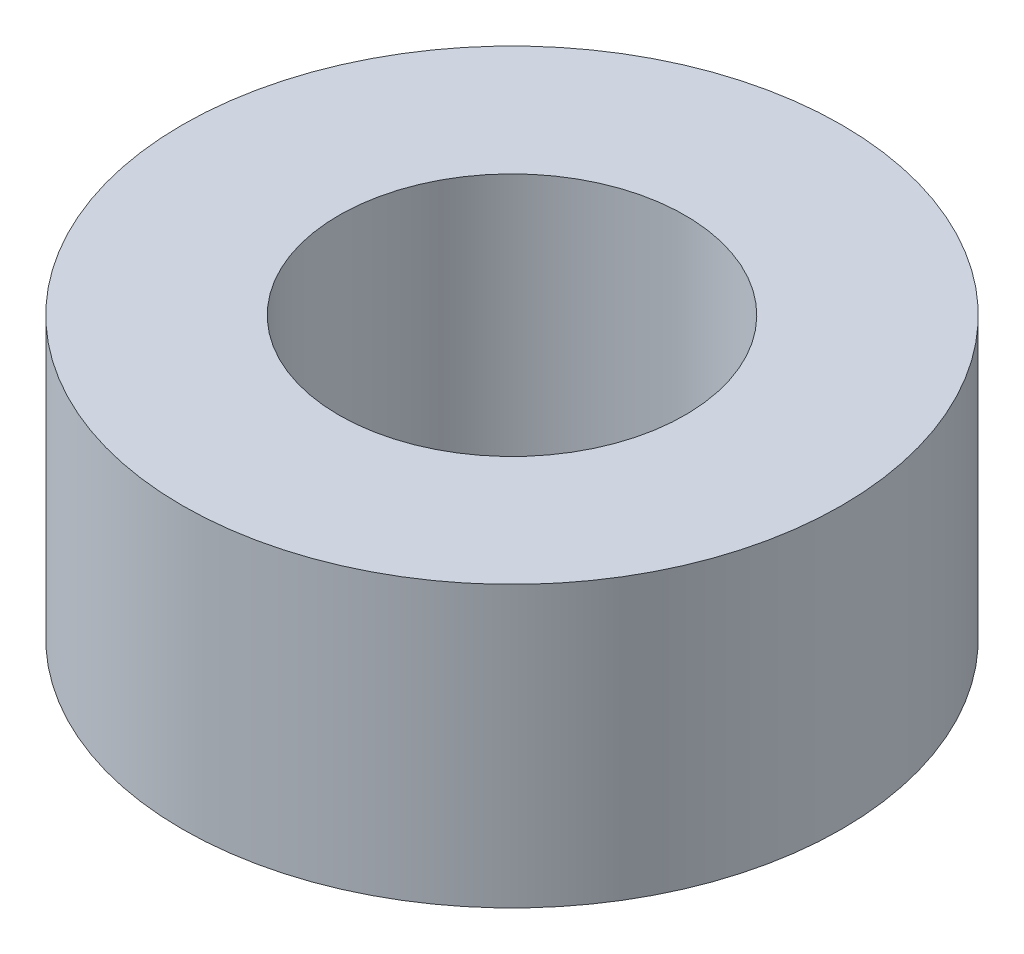
from build123d import *

# Parameters (mm, degrees)
SKETCH1_R           = 12.7
BOSS_EXTRUDE1_DEPTH = 10.795
SKETCH4_R           = 6.6675
CUT_EXTRUDE1_DEPTH  = 21.955


with BuildPart() as part:
    # Sketch1 → Boss-Extrude1 (new body)
    with BuildSketch(Plane(origin=(0, 0, 0), x_dir=(1, 0, 0), z_dir=(0, 1, 0))):
        with Locations(Location((0, 0, 0), (0, 0, 270))):
            Circle(SKETCH1_R)
    extrude(amount=BOSS_EXTRUDE1_DEPTH)

    # Sketch4 → Cut-Extrude1 (cut, through all)
    with BuildSketch(Plane(origin=(0, 10.795, 0), x_dir=(1, 0, 0), z_dir=(0, 1, 0))):
        with Locations(Location((0, 0, 0), (0, 0, 270))):
            Circle(SKETCH4_R)
    extrude(amount=-CUT_EXTRUDE1_DEPTH, mode=Mode.SUBTRACT)


solid = part.part
